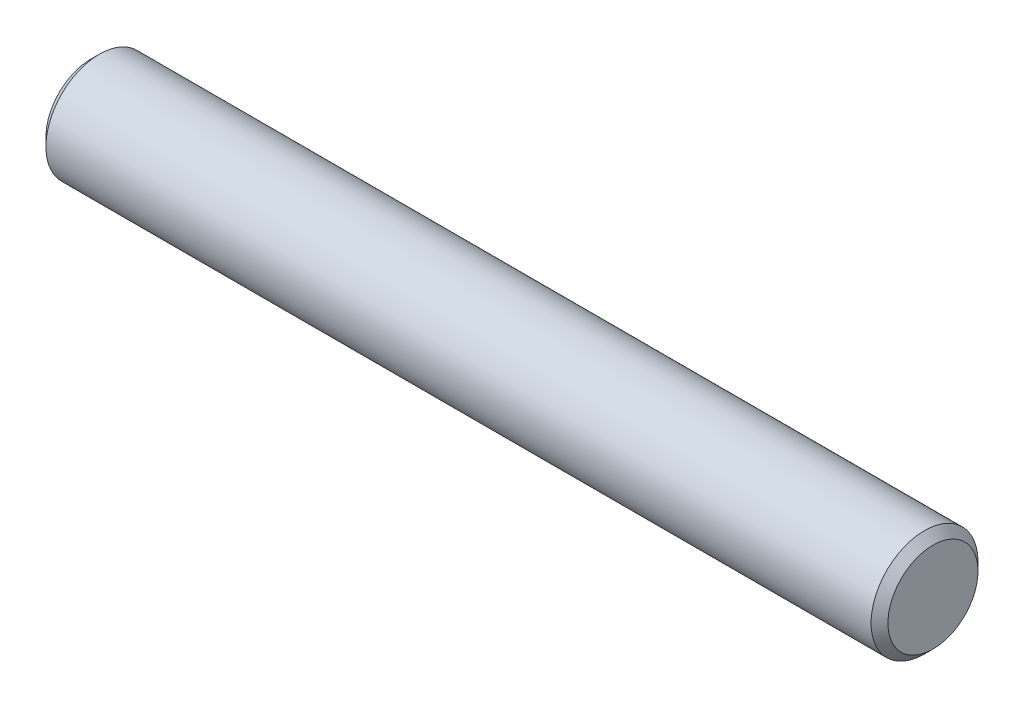
from build123d import *

# Parameters (mm, degrees)
SKETCH_1_R        = 3.175
EXTRUDE_256_DEPTH = 25
CHAMFER_300_SIZE  = 0.5


with BuildPart() as part:
    # 草图1 → Extrude 256 (new, symmetric)
    with BuildSketch(Plane(origin=(0, 0, 0), x_dir=(0, 0, -1), z_dir=(1, 0, 0))):
        Circle(SKETCH_1_R)
    extrude(amount=EXTRUDE_256_DEPTH, both=True)

    # Chamfer 300
    chamfer_300_edges = [part.edges().sort_by_distance(p)[0] for p in [
        (-25, 0, 3.175),
        (25, 0, 3.175),
    ]]
    chamfer(chamfer_300_edges, length=CHAMFER_300_SIZE)


solid = part.part
